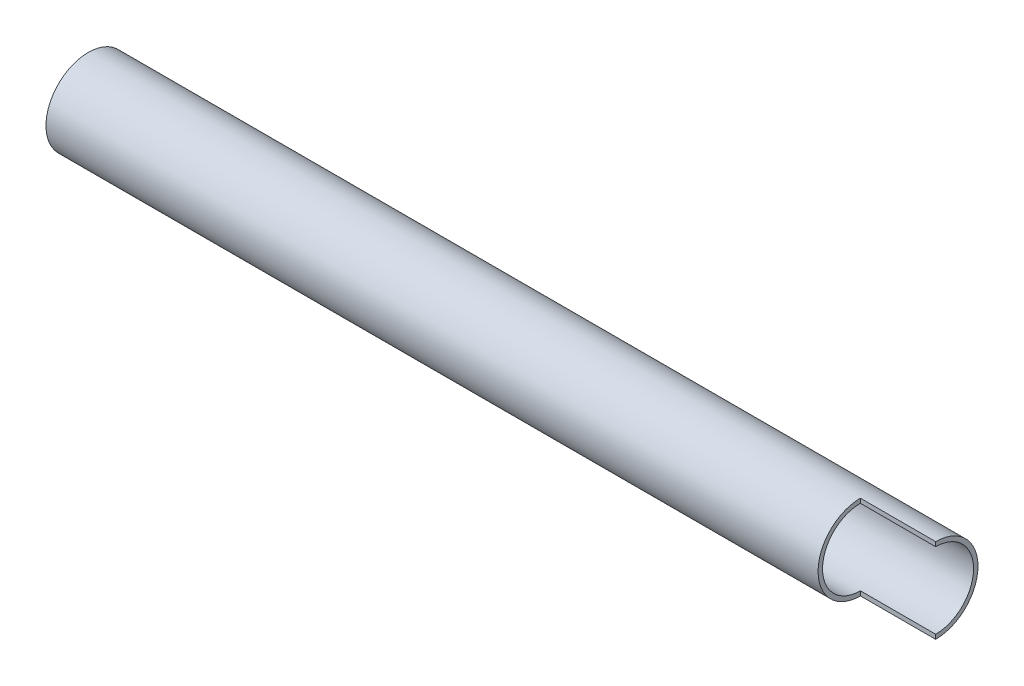
from build123d import *

# Parameters (mm, degrees)
CROQUIS1_R              = 57.15
CROQUIS1_R_2            = 51.15
SALIENTE_EXTRUIR1_DEPTH = 1144
CORTAR_EXTRUIR1_START   = -101.6
CORTAR_EXTRUIR1_DEPTH   = 101.6


with BuildPart() as part:
    # Croquis1 → Saliente-Extruir1 (new body)
    with BuildSketch(Plane(origin=(0, 0, 0), x_dir=(0, 0, -1), z_dir=(1, 0, 0))):
        Circle(CROQUIS1_R)
        Circle(CROQUIS1_R_2, mode=Mode.SUBTRACT)
    extrude(amount=SALIENTE_EXTRUIR1_DEPTH)

    # Croquis3 → Cortar-Extruir1 (cut)
    with BuildSketch(Plane(origin=(1144, 0, 0), x_dir=(0, 0, -1), z_dir=(1, 0, 0)).offset(CORTAR_EXTRUIR1_START)):
        with BuildLine():
            Line((0, 57.15), (0, -57.15))
            ThreePointArc((0, -57.15), (-57.15, 0), (0, 57.15))
        make_face()
    extrude(amount=CORTAR_EXTRUIR1_DEPTH, mode=Mode.SUBTRACT)


solid = part.part
